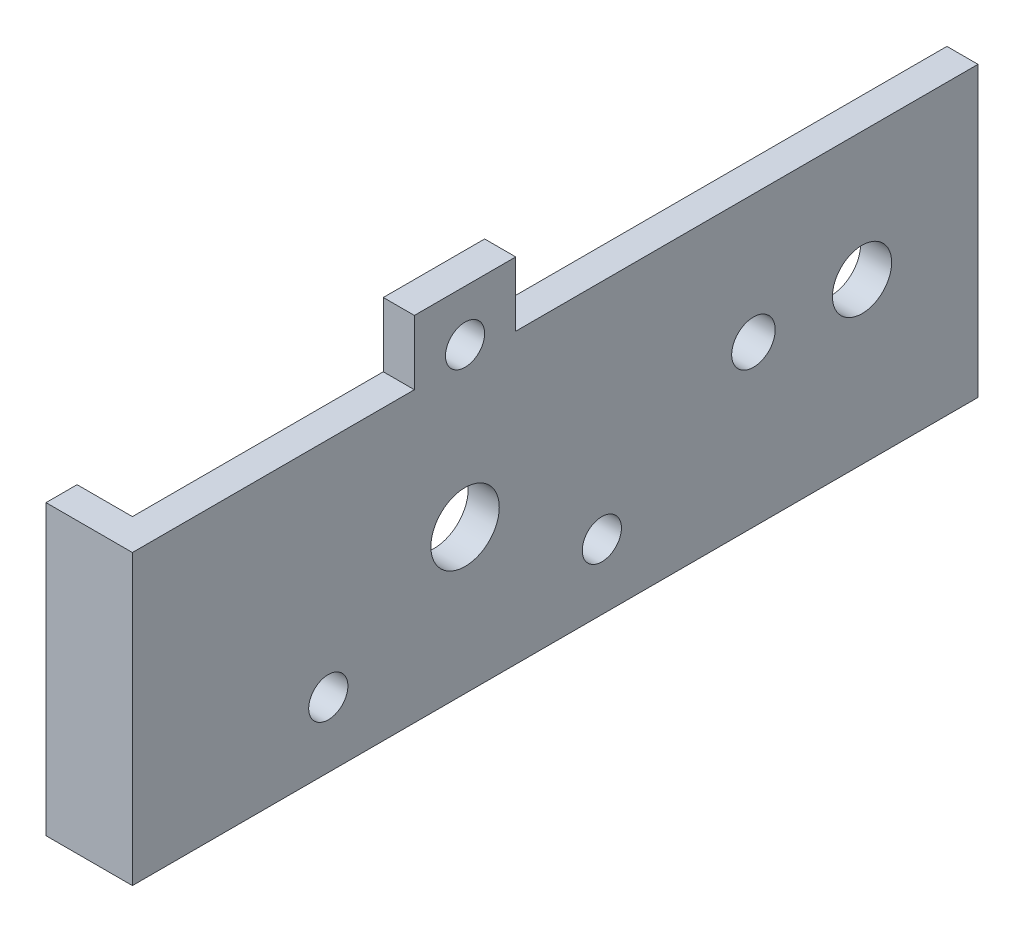
from build123d import *

# Parameters (mm, degrees)
SKETCH8_W                          = 5
SKETCH8_H                          = 46.4
BOSS_EXTRUDE6_DEPTH                = 13.9
SKETCH9_W                          = 5
SKETCH9_H                          = 46.4
BOSS_EXTRUDE7_DEPTH                = 131
SKETCH11_W                         = 16.3
SKETCH11_H                         = 10.35
BOSS_EXTRUDE8_DEPTH                = 5
SKETCH10_R                         = 5.5
SKETCH10_R_2                       = 3.15
CUT_EXTRUDE2_DEPTH                 = 5
SKETCH16_R                         = 4.7625
CUT_EXTRUDE6_DEPTH                 = 9
SKETCH17_R                         = 3.5
CUT_EXTRUDE7_DEPTH                 = 9
M2_5X0_45_TAPPED_HOLE1_D           = 2.05
M2_5X0_45_TAPPED_HOLE1_DEPTH       = 12.5
M2_5X0_45_TAPPED_HOLE1_CSINK_D     = 2.55
M2_5X0_45_TAPPED_HOLE1_CSINK_ANGLE = 90
M2_5X0_45_TAPPED_HOLE1_TIP         = 0.615882135


with BuildPart() as part:
    # Sketch8 → Boss-Extrude6 (new body)
    with BuildSketch(Plane(origin=(0, 0, 0), x_dir=(0, 0, -1), z_dir=(1, 0, 0))):
        with Locations((65.5, 47)):
            Rectangle(SKETCH8_W, SKETCH8_H)
    extrude(amount=BOSS_EXTRUDE6_DEPTH)

    # Sketch9 → Boss-Extrude7 (add)
    with BuildSketch(Plane(origin=(0, 0, -68), x_dir=(-1, 0, 0), z_dir=(0, 0, -1))):
        with Locations((-11.4, 47)):
            Rectangle(SKETCH9_W, SKETCH9_H)
    extrude(amount=BOSS_EXTRUDE7_DEPTH)

    # Sketch11 → Boss-Extrude8 (add)
    with BuildSketch(Plane(origin=(13.9, 0, 0), x_dir=(0, 0, -1), z_dir=(1, 0, 0))):
        with Locations((116.5, 75.375)):
            Rectangle(SKETCH11_W, SKETCH11_H)
    extrude(amount=-BOSS_EXTRUDE8_DEPTH)

    # Sketch10 → Cut-Extrude2 (cut)
    with BuildSketch(Plane(origin=(13.9, 0, 0), x_dir=(0, 0, -1), z_dir=(1, 0, 0))):
        with Locations((116.5, 47)):
            Circle(SKETCH10_R)
        with Locations((116.5, 72.4)):
            Circle(SKETCH10_R_2)
        with Locations((138.497045256, 34.3)):
            Circle(SKETCH10_R_2)
        with Locations((94.502954744, 34.3)):
            Circle(SKETCH10_R_2)
    extrude(amount=-CUT_EXTRUDE2_DEPTH, mode=Mode.SUBTRACT)

    # Sketch16 → Cut-Extrude6 (cut)
    with BuildSketch(Plane(origin=(13.9, 0, 0), x_dir=(0, 0, -1), z_dir=(1, 0, 0))):
        with Locations((180.348526442, 49.5625)):
            Circle(SKETCH16_R)
    extrude(amount=-CUT_EXTRUDE6_DEPTH, mode=Mode.SUBTRACT)

    # Sketch17 → Cut-Extrude7 (cut)
    with BuildSketch(Plane(origin=(13.9, 0, 0), x_dir=(0, 0, -1), z_dir=(1, 0, 0))):
        with Locations((162.886026442, 49.5625)):
            Circle(SKETCH17_R)
    extrude(amount=-CUT_EXTRUDE7_DEPTH, mode=Mode.SUBTRACT)

    # M2.5x0.45 Tapped Hole1
    with Locations(Plane.ZY):
        with Locations((-65.5, 62), (-65.5, 52), (-65.5, 32), (-65.5, 42)):
            CounterSinkHole(M2_5X0_45_TAPPED_HOLE1_D / 2, M2_5X0_45_TAPPED_HOLE1_CSINK_D / 2, depth=M2_5X0_45_TAPPED_HOLE1_DEPTH, counter_sink_angle=M2_5X0_45_TAPPED_HOLE1_CSINK_ANGLE)
            with Locations((0, 0, -(M2_5X0_45_TAPPED_HOLE1_DEPTH + M2_5X0_45_TAPPED_HOLE1_TIP / 2))):  # 118° drill point
                Cone(0, M2_5X0_45_TAPPED_HOLE1_D / 2, M2_5X0_45_TAPPED_HOLE1_TIP, mode=Mode.SUBTRACT)


solid = part.part
